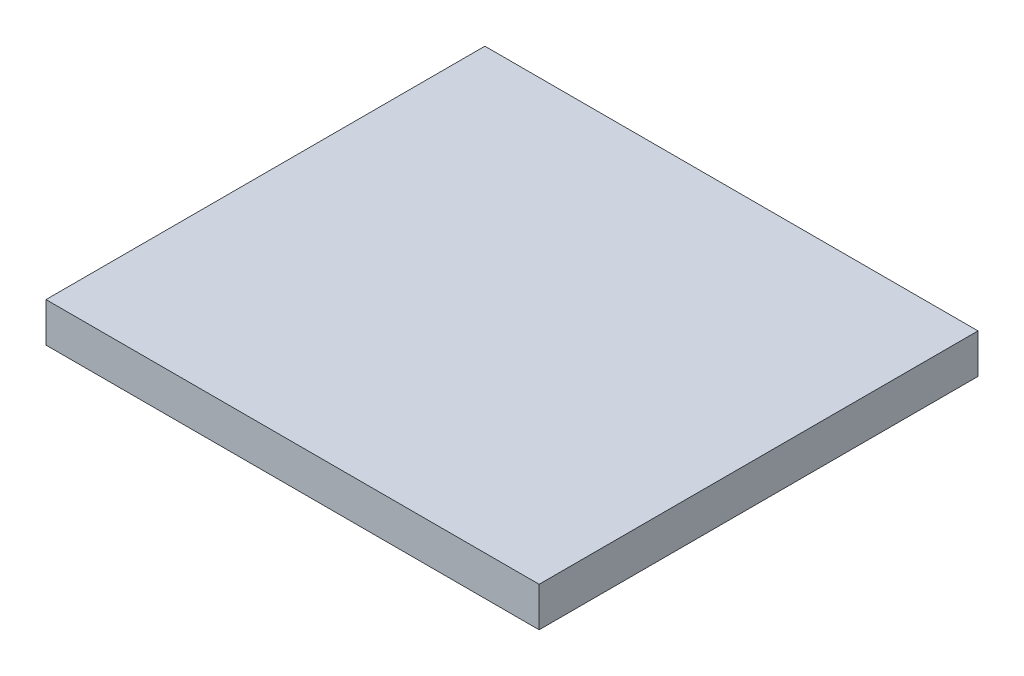
from build123d import *

# Parameters (mm, degrees)
SKETCH_1_W      = 50
SKETCH_1_H      = 44.5
EXTRUDE_1_DEPTH = 4


with BuildPart() as part:
    # 草图1 → 凸台-拉伸1 (new body)
    with BuildSketch(Plane(origin=(0, 0, 0), x_dir=(1, 0, 0), z_dir=(0, 1, 0))):
        with Locations((25, -22.25)):
            Rectangle(SKETCH_1_W, SKETCH_1_H)
    extrude(amount=EXTRUDE_1_DEPTH)


solid = part.part
